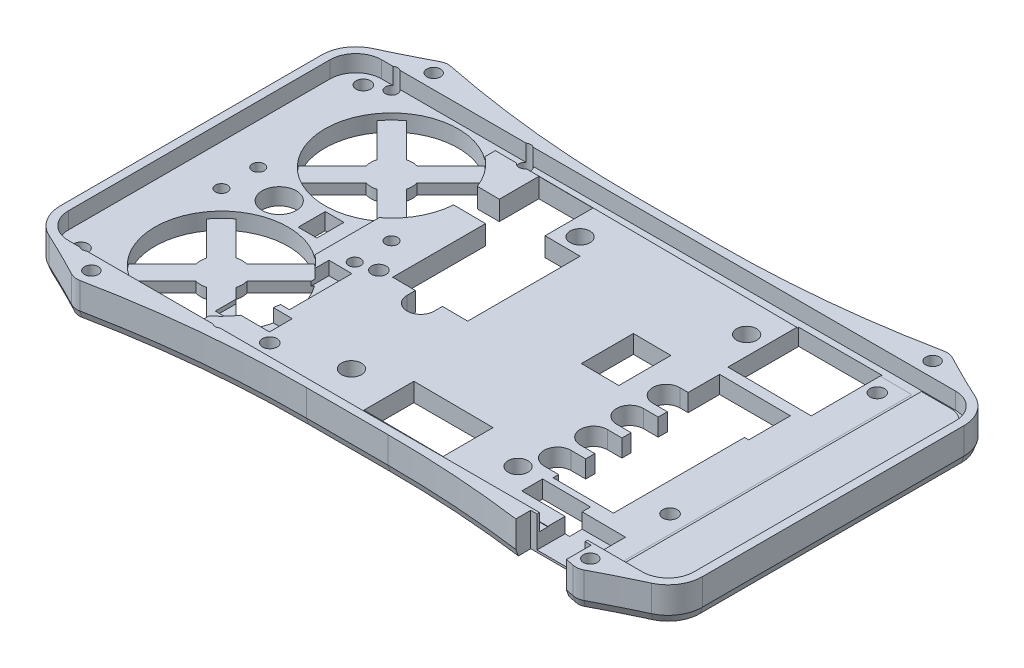
from build123d import *

# Parameters (mm, degrees)
EXTRUDE_1_DEPTH      = 4
EXTRUDE_START        = -2
EXTRUDE_11_DEPTH     = 71.2
SKETCH_2_R           = 2.4
CUT_EXTRUDE_1_DEPTH  = 10
EXTRUDE_9_DEPTH      = 5
EXTRUDE_1_2_DEPTH    = 8
SKETCH_4_W           = 11.5
SKETCH_4_H           = 5
SKETCH_4_W_2         = 9
SKETCH_4_H_2         = 12.5
SKETCH_4_W_3         = 20
SKETCH_4_H_3         = 17
SKETCH_4_W_4         = 19
SKETCH_4_H_4         = 12
CUT_EXTRUDE_2_DEPTH  = 171.57842771
SKETCH_2_11_R        = 4.1
SKETCH_2_11_W        = 4.5
SKETCH_2_11_H        = 6.5
CUT_EXTRUDE_3_DEPTH  = 171.57842771
SKETCH_2_13_R        = 1.75
CUT_EXTRUDE_4_DEPTH  = 171.57842771
CUT_EXTRUDE_START    = -1.5
SKETCH_2_14_W        = 5.5
SKETCH_2_14_H        = 15
SKETCH_2_14_W_2      = 13
SKETCH_2_14_H_2      = 5.5
CUT_EXTRUDE_5_DEPTH  = 170.07842771
SKETCH_6_R           = 3.5
SKETCH_6_R_2         = 1.65
EXTRUDE_10_DEPTH     = 8
SKETCH_6_2_R         = 1.65
CUT_EXTRUDE_9_DEPTH  = 173.893030513
FILLET_1_R           = 250
CHAMFER_1_SIZE       = 0.6
CHAMFER_1_SIZE2      = 1.648486452
SKETCH_8_R           = 1.45
CUT_EXTRUDE_10_DEPTH = 173.893030653
CUT_EXTRUDE_11_DEPTH = 10
SKETCH_10_R          = 16
CUT_EXTRUDE_12_DEPTH = 1.5
CUT_EXTRUDE_START_2  = -3
SKETCH_11_W          = 11.5
SKETCH_11_H          = 20
CUT_EXTRUDE_13_DEPTH = 4.5
SKETCH_12_W          = 14.5
SKETCH_12_H          = 12.84057387
CUT_EXTRUDE_14_DEPTH = 173.893030653
CUT_EXTRUDE_15_REACH = 175.274
SKETCH_13_W          = 11.5
SKETCH_13_H          = 3


with BuildPart() as part:
    # 草图1 → Extrude 1 (new body)
    with BuildSketch(Plane(origin=(0, 0, 0), x_dir=(1, 0, 0), z_dir=(0, 1, 0))):
        with BuildLine():
            Line((6, 0.2), (143.8, 0.2))
            ThreePointArc((143.8, 0.2), (148.184062043, -1.615937957), (150, -6))
            Line((150, -6), (150, -68.8))
            ThreePointArc((150, -68.8), (148.184062043, -73.184062043), (143.8, -75))
            Line((143.8, -75), (6, -75))
            ThreePointArc((6, -75), (1.615937957, -73.184062043), (-0.2, -68.8))
            Line((-0.2, -68.8), (-0.2, -6))
            ThreePointArc((-0.2, -6), (1.615937957, -1.615937957), (6, 0.2))
        make_face()
    extrude(amount=EXTRUDE_1_DEPTH)

    # 草图7 → 凸台-拉伸11 (add)
    with BuildSketch(Plane(origin=(0, 0, -0.2), x_dir=(-1, 0, 0), z_dir=(0, 0, -1)).offset(EXTRUDE_START)):
        Polygon((-135.3, 4), (-35.3, 4.75), (-35.3, 4), align=None)
    extrude(amount=-EXTRUDE_11_DEPTH)

    # 草图2 → 切除-拉伸1 (cut)
    with BuildSketch(Plane(origin=(0, 0, 0), x_dir=(-1, 0, 0), z_dir=(0, -1, 0))):
        with Locations(Location((-103.2, -9.35, 0), (0, 0, 90))):
            Circle(SKETCH_2_R)
        with Locations(Location((-63.2, -9.35, 0), (0, 0, 90))):
            Circle(SKETCH_2_R)
        with Locations(Location((-63.2, -64.25, 0), (0, 0, 90))):
            Circle(SKETCH_2_R)
        with Locations(Location((-103.2, -64.25, 0), (0, 0, 90))):
            Circle(SKETCH_2_R)
    extrude(amount=-CUT_EXTRUDE_1_DEPTH, mode=Mode.SUBTRACT)

    # 草图3 → 凸台-拉伸9 (add)
    with BuildSketch(Plane(origin=(0, 0, 0), x_dir=(1, 0, 0), z_dir=(0, 1, 0))):
        with BuildLine():
            Line((136.8, -1), (136.8, -73.8))
            Line((136.8, -73.8), (143.8, -73.8))
            ThreePointArc((143.8, -73.8), (147.335533906, -72.335533906), (148.8, -68.8))
            Line((148.8, -68.8), (148.8, -6))
            ThreePointArc((148.8, -6), (147.335533906, -2.464466094), (143.8, -1))
            Line((143.8, -1), (136.8, -1))
        make_face()
    extrude(amount=EXTRUDE_9_DEPTH)

    # 草图1<2> → Extrude 1 2 (add)
    with BuildSketch(Plane(origin=(0, 0, 0), x_dir=(1, 0, 0), z_dir=(0, 1, 0))):
        with BuildLine():
            Line((6, 2.2), (143.8, 2.2))
            ThreePointArc((143.8, 2.2), (149.598275606, -0.201724394), (152, -6))
            Line((152, -6), (152, -68.8))
            ThreePointArc((152, -68.8), (149.598275606, -74.598275606), (143.8, -77))
            Line((143.8, -77), (6, -77))
            ThreePointArc((6, -77), (0.201724394, -74.598275606), (-2.2, -68.8))
            Line((-2.2, -68.8), (-2.2, -6))
            ThreePointArc((-2.2, -6), (0.201724394, -0.201724394), (6, 2.2))
        make_face()
        with BuildLine():
            Line((6, 0.2), (143.8, 0.2))
            ThreePointArc((143.8, 0.2), (148.184062043, -1.615937957), (150, -6))
            Line((150, -6), (150, -68.8))
            ThreePointArc((150, -68.8), (148.184062043, -73.184062043), (143.8, -75))
            Line((143.8, -75), (6, -75))
            ThreePointArc((6, -75), (1.615937957, -73.184062043), (-0.2, -68.8))
            Line((-0.2, -68.8), (-0.2, -6))
            ThreePointArc((-0.2, -6), (1.615937957, -1.615937957), (6, 0.2))
        make_face(mode=Mode.SUBTRACT)
    extrude(amount=EXTRUDE_1_2_DEPTH)

    # 草图4 → 切除-拉伸2 (cut, through all)
    with BuildSketch(Plane(origin=(0, 0, 0), x_dir=(1, 0, 0), z_dir=(0, 1, 0))):
        with BuildLine():
            Line((125.2, -30.85), (125.2, -20.85))
            Line((125.2, -20.85), (108.2, -20.85))
            Line((108.2, -20.85), (108.2, -28.4))
            Line((108.2, -28.4), (106.2, -28.4))
            ThreePointArc((106.2, -28.4), (102.95, -31.65), (106.2, -34.9))
            Line((106.2, -34.9), (109.7, -34.9))
            Line((109.7, -34.9), (109.7, -37.1))
            Line((109.7, -37.1), (106.2, -37.1))
            ThreePointArc((106.2, -37.1), (102.95, -40.35), (106.2, -43.6))
            Line((106.2, -43.6), (109.7, -43.6))
            Line((109.7, -43.6), (109.7, -45.8))
            Line((109.7, -45.8), (106.2, -45.8))
            ThreePointArc((106.2, -45.8), (102.95, -49.05), (106.2, -52.3))
            Line((106.2, -52.3), (109.7, -52.3))
            Line((109.7, -52.3), (109.7, -54.5))
            Line((109.7, -54.5), (106.2, -54.5))
            ThreePointArc((106.2, -54.5), (102.95, -57.75), (106.2, -61))
            Line((106.2, -61), (109.7, -61))
            Line((109.7, -61), (109.7, -62.35))
            Line((109.7, -62.35), (124.2, -62.35))
            Line((124.2, -62.35), (124.2, -30.85))
            Line((124.2, -30.85), (125.2, -30.85))
        make_face()
        with Locations((114.45, -66.35)):
            Rectangle(SKETCH_4_W, SKETCH_4_H)
        with BuildLine():
            Line((67.2, -13.35), (58.8, -13.35))
            Line((58.8, -13.35), (58.8, -1.85))
            Line((58.8, -1.85), (45.8, -1.85))
            Line((45.8, -1.85), (45.8, -11.35))
            Line((45.8, -11.35), (39.8, -11.35))
            Line((39.8, -11.35), (39.8, -18.05))
            Line((39.8, -18.05), (49.2, -18.05))
            Line((49.2, -18.05), (49.2, -40.35))
            Line((49.2, -40.35), (54.65, -40.35))
            Line((54.65, -40.35), (54.65, -42.35))
            ThreePointArc((54.65, -42.35), (57.9, -45.6), (61.15, -42.35))
            Line((61.15, -42.35), (61.15, -40.35))
            Line((61.15, -40.35), (67.2, -40.35))
            Line((67.2, -40.35), (67.2, -13.35))
        make_face()
        with Locations((94, -29.1)):
            Rectangle(SKETCH_4_W_2, SKETCH_4_H_2)
        with Locations((117.7, -9.85)):
            Rectangle(SKETCH_4_W_3, SKETCH_4_H_3)
        with Locations((82.7, -65.25)):
            Rectangle(SKETCH_4_W_4, SKETCH_4_H_4)
    extrude(amount=CUT_EXTRUDE_2_DEPTH, mode=Mode.SUBTRACT)

    # 草图2<11> → 切除-拉伸3 (cut, through all)
    with BuildSketch(Plane(origin=(0, 0, 0), x_dir=(-1, 0, 0), z_dir=(0, -1, 0))):
        with Locations(Location((-19, -37.4, 0), (0, 0, 90))):
            Circle(SKETCH_2_11_R)
        with Locations((-29.05, -37.4)):
            Rectangle(SKETCH_2_11_W, SKETCH_2_11_H)
    extrude(amount=-CUT_EXTRUDE_3_DEPTH, mode=Mode.SUBTRACT)

    # 草图2<13> → 切除-拉伸4 (cut, through all)
    with BuildSketch(Plane(origin=(0, 0, 0), x_dir=(-1, 0, 0), z_dir=(0, -1, 0))):
        with Locations(Location((-130.8, -5.6, 0), (0, 0, 90))):
            Circle(SKETCH_2_13_R)
        with Locations(Location((-131.1, -55.65, 0), (0, 0, 90))):
            Circle(SKETCH_2_13_R)
        with Locations(Location((-48.1, -68.75, 0), (0, 0, 90))):
            Circle(SKETCH_2_13_R)
        with Locations(Location((-5.05, -71.05, 0), (0, 0, 90))):
            Circle(SKETCH_2_13_R)
        with Locations(Location((-5.05, -3.25, 0), (0, 0, 90))):
            Circle(SKETCH_2_13_R)
        with Locations((-47.7, -4.85)):
            Circle(SKETCH_2_13_R)
        with Locations(Location((-46.11, -40.57, 0), (0, 0, 90))):
            Circle(SKETCH_2_13_R)
    extrude(amount=-CUT_EXTRUDE_4_DEPTH, mode=Mode.SUBTRACT)

    # 草图2<14> → 切除-拉伸5 (cut, through all)
    with BuildSketch(Plane(origin=(0, 0, 0), x_dir=(-1, 0, 0), z_dir=(0, -1, 0)).offset(CUT_EXTRUDE_START)):
        with Locations((-40.85, -52.05)):
            Rectangle(SKETCH_2_14_W, SKETCH_2_14_H)
        with Locations((-39.3, -63.8)):
            Rectangle(SKETCH_2_14_W_2, SKETCH_2_14_H_2)
    extrude(amount=-CUT_EXTRUDE_5_DEPTH, mode=Mode.SUBTRACT)

    # 草图6 → 凸台-拉伸10 (add)
    # profile 1 of 4: a face of its own
    with BuildSketch(Plane(origin=(0, 0, 0), x_dir=(1, 0, 0), z_dir=(0, 1, 0))):
        with Locations((15, 3.7)):
            Circle(SKETCH_6_R)
        with Locations((15, 3.7)):
            Circle(SKETCH_6_R_2, mode=Mode.SUBTRACT)
    # profile 2 of 4: a face of its own
    with BuildSketch(Plane(origin=(0, 0, 0), x_dir=(1, 0, 0), z_dir=(0, 1, 0))):
        with Locations((15, -78.5)):
            Circle(SKETCH_6_R)
        with Locations((15, -78.5)):
            Circle(SKETCH_6_R_2, mode=Mode.SUBTRACT)
    # profile 3 of 4: a face of its own
    with BuildSketch(Plane(origin=(0, 0, 0), x_dir=(1, 0, 0), z_dir=(0, 1, 0))):
        with Locations((134.8, 3.7)):
            Circle(SKETCH_6_R)
        with Locations((134.8, 3.7)):
            Circle(SKETCH_6_R_2, mode=Mode.SUBTRACT)
    # profile 4 of 4: a face of its own
    with BuildSketch(Plane(origin=(0, 0, 0), x_dir=(1, 0, 0), z_dir=(0, 1, 0))):
        with Locations((134.8, -78.5)):
            Circle(SKETCH_6_R)
        with Locations((134.8, -78.5)):
            Circle(SKETCH_6_R_2, mode=Mode.SUBTRACT)
    extrude(amount=EXTRUDE_10_DEPTH)

    # 草图6<2> → 切除-拉伸9 (cut, through all)
    with BuildSketch(Plane(origin=(0, 0, 0), x_dir=(1, 0, 0), z_dir=(0, 1, 0))):
        with Locations(Location((15, 3.7, 0), (0, 0, 90))):
            Circle(SKETCH_6_2_R)
        with Locations(Location((134.8, 3.7, 0), (0, 0, 90))):
            Circle(SKETCH_6_2_R)
        with Locations(Location((134.8, -78.5, 0), (0, 0, 90))):
            Circle(SKETCH_6_2_R)
        with Locations(Location((15, -78.5, 0), (0, 0, 90))):
            Circle(SKETCH_6_2_R)
    extrude(amount=CUT_EXTRUDE_9_DEPTH, mode=Mode.SUBTRACT)

    # 圆角1
    fillet_1_edges = [part.edges().sort_by_distance(p)[0] for p in [
        (18.16227766, 4, 77),
        (11.83772234, 4, 77),
        (137.96227766, 4, 77),
        (131.63772234, 4, 77),
        (131.63772234, 4, -2.2),
        (137.96227766, 4, -2.2),
        (11.83772234, 4, -2.2),
        (18.16227766, 4, -2.2),
    ]]
    fillet(fillet_1_edges, radius=FILLET_1_R)

    # 倒角1
    chamfer_1_edges = [part.edges().sort_by_distance(p)[0] for p in [
        (14.502874151, 0, 81.964515246),
        (74.9, 0, 77),
        (135.297125849, 0, 81.964515246),
        (150.714252509, 0, 73.20830038),
        (135.297125849, 0, -7.164515246),
        (74.9, 0, -2.2),
        (14.502874151, 0, -7.164515246),
        (-0.914252509, 0, 1.59169962),
        (40.273083878, 0, 78.235796001),
        (7.988030543, 0, 78.850628869),
        (109.526916122, 0, 78.235796001),
        (141.811969457, 0, 78.850628869),
        (141.811969457, 0, -4.050628869),
        (109.526916122, 0, -3.435796001),
        (7.988030543, 0, -4.050628869),
        (40.273083878, 0, -3.435796001),
        (-2.2, 0, 37.4),
        (-0.914252509, 0, 73.20830038),
        (152, 0, 37.4),
        (150.714252509, 0, 1.59169962),
    ]]
    chamfer_1_side = [part.faces().sort_by_distance(p)[0] for p in [
        (71.569162832, 0, 38.32888887),
    ]]
    chamfer(chamfer_1_edges, length=CHAMFER_1_SIZE, length2=CHAMFER_1_SIZE2, reference=chamfer_1_side[0])

    # 草图8 → 切除-拉伸10 (cut, through all)
    with BuildSketch(Plane.XZ):
        with Locations(Location((41.552498021, 0.980721458, 0), (0, 0, 270))):
            Circle(SKETCH_8_R)
        with Locations(Location((41.552498021, 32.980721458, 0), (0, 0, 270))):
            Circle(SKETCH_8_R)
        with Locations(Location((9.552498021, 32.980721458, 0), (0, 0, 270))):
            Circle(SKETCH_8_R)
        with Locations(Location((9.552498021, 0.980721458, 0), (0, 0, 270))):
            Circle(SKETCH_8_R)
        with Locations(Location((9.552498021, 73.819278542, 0), (0, 0, 54.517284302))):
            Circle(SKETCH_8_R)
        with Locations(Location((9.552498021, 41.819278542, 0), (0, 0, 90))):
            Circle(SKETCH_8_R)
        with Locations((41.552498021, 41.819278542)):
            Circle(SKETCH_8_R)
        with Locations(Location((41.552498021, 73.819278542, 0), (0, 0, 325.596341786))):
            Circle(SKETCH_8_R)
    extrude(amount=-CUT_EXTRUDE_10_DEPTH, mode=Mode.SUBTRACT)

    # 草图9 → 切除-拉伸11 (cut)
    with BuildSketch(Plane.XZ):
        with BuildLine():
            ThreePointArc((34.959479388, 29.92323673), (25.552498021, 32.980721458), (16.145516655, 29.92323673))
            Line((16.145516655, 29.92323673), (24.258402796, 21.81035059))
            ThreePointArc((24.258402796, 21.81035059), (25.552498021, 21.980721458), (26.846593247, 21.81035059))
            Line((26.846593247, 21.81035059), (34.959479388, 29.92323673))
        make_face()
        with BuildLine():
            ThreePointArc((41.552498021, 16.980721458), (40.768940515, 21.926414314), (38.495013293, 26.387702825))
            Line((38.495013293, 26.387702825), (30.382127153, 18.274816684))
            ThreePointArc((30.382127153, 18.274816684), (30.509722328, 17.633352419), (30.552498021, 16.980721458))
            ThreePointArc((30.552498021, 16.980721458), (30.509722328, 16.328090497), (30.382127153, 15.686626233))
            Line((30.382127153, 15.686626233), (38.495013293, 7.573740092))
            ThreePointArc((38.495013293, 7.573740092), (40.768940515, 12.035028603), (41.552498021, 16.980721458))
        make_face()
        with BuildLine():
            Line((24.258402796, 12.151092327), (16.145516655, 4.038206186))
            ThreePointArc((16.145516655, 4.038206186), (25.552498021, 0.980721458), (34.959479388, 4.038206186))
            Line((34.959479388, 4.038206186), (26.846593247, 12.151092327))
            ThreePointArc((26.846593247, 12.151092327), (25.552498021, 11.980721458), (24.258402796, 12.151092327))
        make_face()
        with BuildLine():
            Line((20.72286889, 18.274816684), (12.609982749, 26.387702825))
            ThreePointArc((12.609982749, 26.387702825), (9.552498021, 16.980721458), (12.609982749, 7.573740092))
            Line((12.609982749, 7.573740092), (20.72286889, 15.686626233))
            ThreePointArc((20.72286889, 15.686626233), (20.552498021, 16.980721458), (20.72286889, 18.274816684))
        make_face()
        with BuildLine():
            ThreePointArc((12.609982749, 67.226259908), (9.552498021, 57.819278542), (12.609982749, 48.412297175))
            Line((12.609982749, 48.412297175), (20.72286889, 56.525183316))
            ThreePointArc((20.72286889, 56.525183316), (20.552498021, 57.819278542), (20.72286889, 59.113373767))
            Line((20.72286889, 59.113373767), (12.609982749, 67.226259908))
        make_face()
        with BuildLine():
            Line((26.846593247, 62.648907673), (34.959479388, 70.761793814))
            ThreePointArc((34.959479388, 70.761793814), (25.552498021, 73.819278542), (16.145516655, 70.761793814))
            Line((16.145516655, 70.761793814), (24.258402796, 62.648907673))
            ThreePointArc((24.258402796, 62.648907673), (25.552498021, 62.819278542), (26.846593247, 62.648907673))
        make_face()
        with BuildLine():
            Line((30.382127153, 56.525183316), (38.495013293, 48.412297175))
            ThreePointArc((38.495013293, 48.412297175), (40.768940515, 52.873585686), (41.552498021, 57.819278542))
            ThreePointArc((41.552498021, 57.819278542), (40.768940515, 62.764971397), (38.495013293, 67.226259908))
            Line((38.495013293, 67.226259908), (30.382127153, 59.113373767))
            ThreePointArc((30.382127153, 59.113373767), (30.509722328, 58.471909503), (30.552498021, 57.819278542))
            ThreePointArc((30.552498021, 57.819278542), (30.509722328, 57.166647581), (30.382127153, 56.525183316))
        make_face()
        with BuildLine():
            ThreePointArc((16.145516655, 44.87676327), (25.552498021, 41.819278542), (34.959479388, 44.87676327))
            Line((34.959479388, 44.87676327), (26.846593247, 52.98964941))
            ThreePointArc((26.846593247, 52.98964941), (25.552498021, 52.819278542), (24.258402796, 52.98964941))
            Line((24.258402796, 52.98964941), (16.145516655, 44.87676327))
        make_face()
    extrude(amount=-CUT_EXTRUDE_11_DEPTH, mode=Mode.SUBTRACT)

    # 草图10 → 切除-拉伸12 (cut, symmetric)
    with BuildSketch(Plane(origin=(0, 4, 0), x_dir=(1, 0, 0), z_dir=(0, 1, 0))):
        with Locations((25.552498021, -16.980721458)):
            Circle(SKETCH_10_R)
        with Locations((25.552498021, -57.819278542)):
            Circle(SKETCH_10_R)
    extrude(amount=CUT_EXTRUDE_12_DEPTH, both=True, mode=Mode.SUBTRACT)

    # 草图11 → 切除-拉伸13 (cut)
    with BuildSketch(Plane(origin=(0, 8, 0), x_dir=(1, 0, 0), z_dir=(0, 1, 0)).offset(CUT_EXTRUDE_START_2)):
        with Locations((124.85, -75.85)):
            Rectangle(SKETCH_11_W, SKETCH_11_H)
    extrude(amount=-CUT_EXTRUDE_13_DEPTH, mode=Mode.SUBTRACT)

    # 草图12 → 切除-拉伸14 (cut, through all)
    with BuildSketch(Plane(origin=(0, 8, 0), x_dir=(1, 0, 0), z_dir=(0, 1, 0))):
        with Locations((124.85, -82.020286935)):
            Rectangle(SKETCH_12_W, SKETCH_12_H)
    extrude(amount=-CUT_EXTRUDE_14_DEPTH, mode=Mode.SUBTRACT)

    # 草图13 → 切除-拉伸15 (cut, up to next)
    with BuildSketch(Plane.XY.offset(75.6), mode=Mode.PRIVATE) as cut_extrude_15_sk1:
        with Locations((124.85, 6.5)):
            Rectangle(SKETCH_13_W, SKETCH_13_H)
    cut_extrude_15_tool1 = extrude(cut_extrude_15_sk1.sketch, amount=-CUT_EXTRUDE_15_REACH, mode=Mode.PRIVATE) & part.part
    add(cut_extrude_15_tool1.solids().sort_by_distance((124.85, 6.5, 75.6))[0], mode=Mode.SUBTRACT)


solid = part.part
